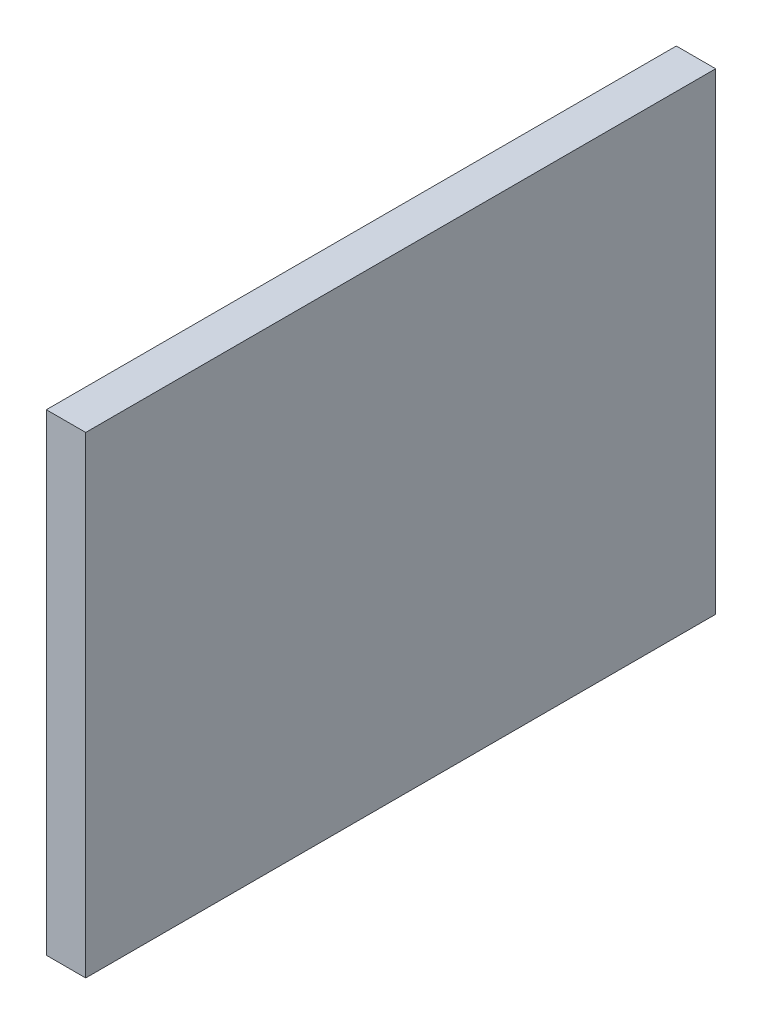
from build123d import *
from build123d.topology import SkipClean

# Parameters (mm, degrees)
BOSS_EXTRUDE1_DEPTH = 12
SKETCH2_R           = 0.5
BOSS_EXTRUDE2_DEPTH = 6
SKETCH3_W           = 80
SKETCH3_H           = 60
BOSS_EXTRUDE3_DEPTH = 5


with BuildPart() as part:
    # Sketch1 → Boss-Extrude1 (new body)
    with BuildSketch(Plane(origin=(19, 0, 0), x_dir=(0, 0, -1), z_dir=(1, 0, 0))):
        with BuildLine():
            Line((-17.5, 6.6), (-15.77498019, 6.6))
            ThreePointArc((-15.77498019, 6.6), (0, 17.1), (15.77498019, 6.6))
            Line((15.77498019, 6.6), (17.5, 6.6))
            ThreePointArc((17.5, 6.6), (24.1, 0), (17.5, -6.6))
            Line((17.5, -6.6), (15.77498019, -6.6))
            ThreePointArc((15.77498019, -6.6), (14.603463036, -8.896564918), (13.1, -10.990905331))
            Line((13.1, -10.990905331), (13.1, -12.489995997))
            ThreePointArc((13.1, -12.489995997), (11.807309956, -13.718506901), (10.4, -14.813844876))
            Line((10.4, -14.813844876), (10.4, -16))
            ThreePointArc((10.4, -16), (9.199137803, -18.899137803), (6.3, -20.1))
            Line((6.3, -20.1), (-6.3, -20.1))
            ThreePointArc((-6.3, -20.1), (-9.199137803, -18.899137803), (-10.4, -16))
            Line((-10.4, -16), (-10.4, -14.813844876))
            ThreePointArc((-10.4, -14.813844876), (-11.807309956, -13.718506901), (-13.1, -12.489995997))
            Line((-13.1, -12.489995997), (-13.1, -10.990905331))
            ThreePointArc((-13.1, -10.990905331), (-14.603463036, -8.896564918), (-15.77498019, -6.6))
            Line((-15.77498019, -6.6), (-17.5, -6.6))
            ThreePointArc((-17.5, -6.6), (-24.1, 0), (-17.5, 6.6))
        make_face()
        with BuildLine():
            Line((10.1, -9.838699101), (10.1, -11.22497216))
            ThreePointArc((10.1, -11.22497216), (8.803462488, -12.268212919), (7.4, -13.162446581))
            Line((7.4, -13.162446581), (7.4, -16))
            ThreePointArc((7.4, -16), (7.077817459, -16.777817459), (6.3, -17.1))
            Line((6.3, -17.1), (-6.3, -17.1))
            ThreePointArc((-6.3, -17.1), (-7.077817459, -16.777817459), (-7.4, -16))
            Line((-7.4, -16), (-7.4, -13.162446581))
            ThreePointArc((-7.4, -13.162446581), (-8.803462488, -12.268212919), (-10.1, -11.22497216))
            Line((-10.1, -11.22497216), (-10.1, -9.838699101))
            ThreePointArc((-10.1, -9.838699101), (-12.269489895, -6.947633965), (-13.632681321, -3.6))
            ThreePointArc((-13.632681321, -3.6), (-14.1, 0), (-13.632681321, 3.6))
            ThreePointArc((-13.632681321, 3.6), (0, 14.1), (13.632681321, 3.6))
            ThreePointArc((13.632681321, 3.6), (14.1, 0), (13.632681321, -3.6))
            ThreePointArc((13.632681321, -3.6), (12.269489895, -6.947633965), (10.1, -9.838699101))
        make_face(mode=Mode.SUBTRACT)
    extrude(amount=-BOSS_EXTRUDE1_DEPTH)

    # Sketch2 → Boss-Extrude2 (add)
    # profile 1 of 2: a face of its own
    with SkipClean():  # the faces are left unmerged after this step: merging them gives an invalid solid
        with BuildSketch(Plane.ZY.offset(-7)):
            with BuildLine():
                Line((17.5, 3.5), (13.658696863, 3.5))
                ThreePointArc((13.658696863, 3.5), (14.1, 0), (13.658696863, -3.5))
                Line((13.658696863, -3.5), (17.5, -3.5))
                ThreePointArc((17.5, -3.5), (21, 0), (17.5, 3.5))
            make_face()
            with Locations(Location((17.5, 0, 0), (0, 0, 270))):
                Circle(SKETCH2_R, mode=Mode.SUBTRACT)
        # profile 2 of 2: a face of its own
        with BuildSketch(Plane.ZY.offset(-7)):
            with BuildLine():
                Line((-13.658696863, 3.5), (-17.5, 3.5))
                ThreePointArc((-17.5, 3.5), (-21, 0), (-17.5, -3.5))
                Line((-17.5, -3.5), (-13.658696863, -3.5))
                ThreePointArc((-13.658696863, -3.5), (-14.1, 0), (-13.658696863, 3.5))
            make_face()
            with Locations(Location((-17.5, 0, 0), (0, 0, 270))):
                Circle(SKETCH2_R, mode=Mode.SUBTRACT)
        extrude(amount=BOSS_EXTRUDE2_DEPTH)

    # Sketch3 → Boss-Extrude3 (add)
    with SkipClean():  # the faces are left unmerged after this step: merging them gives an invalid solid
        with BuildSketch(Plane(origin=(19, 0, 0), x_dir=(0, 0, -1), z_dir=(1, 0, 0))):
            Rectangle(SKETCH3_W, SKETCH3_H)
        extrude(amount=BOSS_EXTRUDE3_DEPTH)


solid = part.part
